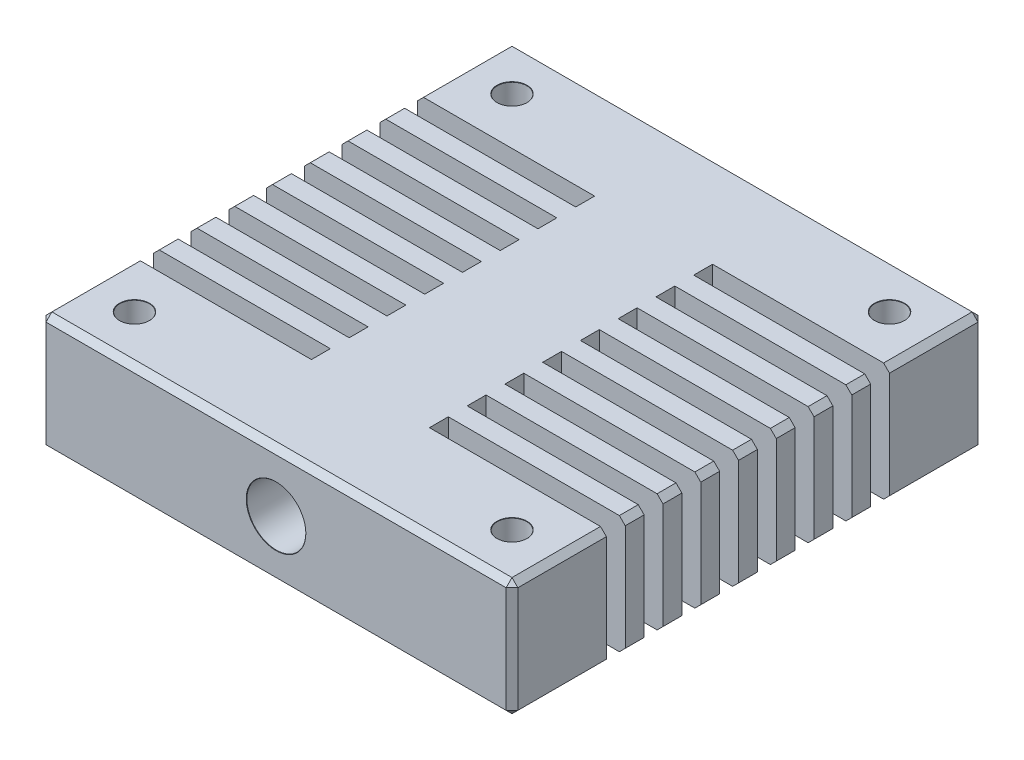
from build123d import *

# Parameters (mm, degrees)
ESQUISSE1_W                                         = 40
ESQUISSE1_H                                         = 40
BOSS_EXTRU_1_DEPTH                                  = 10
DIAM_TRE_DU_PER_AGE_4_0_4_1_D                       = 4
TROU_POUR_TARAUDAGE_POUR_TROU_TARAUD_M6_D           = 5
TROU_POUR_TARAUDAGE_POUR_TROU_TARAUD_M6_DEPTH       = 8
TROU_POUR_TARAUDAGE_POUR_TROU_TARAUD_M6_CSINK_D     = 5.05
TROU_POUR_TARAUDAGE_POUR_TROU_TARAUD_M6_CSINK_ANGLE = 90
TROU_POUR_TARAUDAGE_POUR_TROU_TARAUD_M6_TIP         = 1.502151548
DIAM_TRE_DU_PER_AGE_6_0_6_1_D                       = 6
DIAM_TRE_DU_PER_AGE_6_0_6_1_DEPTH                   = 20
DIAM_TRE_DU_PER_AGE_6_0_6_1_TIP                     = 1.802581857
TROU_POUR_TARAUDAGE_POUR_TROU_TARAUD_2_COUNT        = 2
TROU_POUR_TARAUDAGE_POUR_TROU_TARAUD_2_PITCH        = 32
TROU_POUR_TARAUDAGE_POUR_TROU_TARAUD_3_COUNT        = 2
TROU_POUR_TARAUDAGE_POUR_TROU_TARAUD_3_PITCH        = 45.254833996
TROU_POUR_TARAUDAGE_POUR_TROU_TARAUD_4_COUNT        = 2
TROU_POUR_TARAUDAGE_POUR_TROU_TARAUD_4_PITCH        = 32
TROU_POUR_TARAUDAGE_POUR_TROU_TARAUD_5_D            = 2.5
TROU_POUR_TARAUDAGE_POUR_TROU_TARAUD_5_DEPTH        = 5
TROU_POUR_TARAUDAGE_POUR_TROU_TARAUD_5_CSINK_D      = 2.55
TROU_POUR_TARAUDAGE_POUR_TROU_TARAUD_5_CSINK_ANGLE  = 90
TROU_POUR_TARAUDAGE_POUR_TROU_TARAUD_5_TIP          = 0.751075774
ESQUISSE21_W                                        = 15
ESQUISSE21_H                                        = 1.6
ENL_V_MAT_EXTRU_1_DEPTH                             = 58.445626535
R_P_TITION_LIN_AIRE1_COUNT                          = 8
R_P_TITION_LIN_AIRE1_PITCH                          = 3.2
CHANFREIN1_SIZE                                     = 0.5


with BuildPart() as part:
    # Esquisse1 → Boss.-Extru.1 (new body)
    with BuildSketch(Plane(origin=(0, 0, 0), x_dir=(1, 0, 0), z_dir=(0, 1, 0))):
        with Locations((20, 20)):
            Rectangle(ESQUISSE1_W, ESQUISSE1_H)
    extrude(amount=BOSS_EXTRU_1_DEPTH)

    # Diamètre du perçage Ø4.0 (4)1 (through all)
    with Locations(Plane.XY):
        with Locations((20, 5)):
            Hole(DIAM_TRE_DU_PER_AGE_4_0_4_1_D / 2)

    # Trou pour taraudage pour trou taraudé M61
    with Locations(Plane.XY):
        with Locations((20, 5)):
            CounterSinkHole(TROU_POUR_TARAUDAGE_POUR_TROU_TARAUD_M6_D / 2, TROU_POUR_TARAUDAGE_POUR_TROU_TARAUD_M6_CSINK_D / 2, depth=TROU_POUR_TARAUDAGE_POUR_TROU_TARAUD_M6_DEPTH, counter_sink_angle=TROU_POUR_TARAUDAGE_POUR_TROU_TARAUD_M6_CSINK_ANGLE)
            with Locations((0, 0, -(TROU_POUR_TARAUDAGE_POUR_TROU_TARAUD_M6_DEPTH + TROU_POUR_TARAUDAGE_POUR_TROU_TARAUD_M6_TIP / 2))):  # 118° drill point
                Cone(0, TROU_POUR_TARAUDAGE_POUR_TROU_TARAUD_M6_D / 2, TROU_POUR_TARAUDAGE_POUR_TROU_TARAUD_M6_TIP, mode=Mode.SUBTRACT)

    # Diamètre du perçage Ø6.0 (6)1
    with Locations(Plane(origin=(0, 0, -40), x_dir=(-1, 0, 0), z_dir=(0, 0, -1))):
        with Locations((-20, 5)):
            Hole(DIAM_TRE_DU_PER_AGE_6_0_6_1_D / 2, depth=DIAM_TRE_DU_PER_AGE_6_0_6_1_DEPTH)
            with Locations((0, 0, -(DIAM_TRE_DU_PER_AGE_6_0_6_1_DEPTH + DIAM_TRE_DU_PER_AGE_6_0_6_1_TIP / 2))):  # 118° drill point
                Cone(0, DIAM_TRE_DU_PER_AGE_6_0_6_1_D / 2, DIAM_TRE_DU_PER_AGE_6_0_6_1_TIP, mode=Mode.SUBTRACT)

    # Esquisse17 → Trou pour taraudage pour trou taraud_ M3 (revolve, cut)
    with BuildSketch(Plane(origin=(4, 0, -4), x_dir=(0, 0, -1), z_dir=(1, 0, 0))):
        Polygon((0, 0), (0, 10), (1.275, 10), (1.25, 9.975), (1.25, 0.025), (1.275, 0), align=None)
    trou_pour_taraudage_pour_trou_taraud_m3 = revolve(axis=Axis((4, -6.35, -4), (0, 1, 0)), mode=Mode.SUBTRACT)

    # Trou pour taraudage pour trou taraud 2: Trou pour taraudage pour trou taraud_ M3 ×2
    with Locations(*[(i * TROU_POUR_TARAUDAGE_POUR_TROU_TARAUD_2_PITCH, 0, 0) for i in range(1, TROU_POUR_TARAUDAGE_POUR_TROU_TARAUD_2_COUNT)]):
        add(trou_pour_taraudage_pour_trou_taraud_m3, mode=Mode.SUBTRACT)

    # Trou pour taraudage pour trou taraud 3: Trou pour taraudage pour trou taraud_ M3 ×2
    with Locations(*[Vector(0.7071067811865475, 0, -0.7071067811865476) * (i * TROU_POUR_TARAUDAGE_POUR_TROU_TARAUD_3_PITCH) for i in range(1, TROU_POUR_TARAUDAGE_POUR_TROU_TARAUD_3_COUNT)]):
        add(trou_pour_taraudage_pour_trou_taraud_m3, mode=Mode.SUBTRACT)

    # Trou pour taraudage pour trou taraud 4: Trou pour taraudage pour trou taraud_ M3 ×2
    with Locations(*[(0, 0, -i * TROU_POUR_TARAUDAGE_POUR_TROU_TARAUD_4_PITCH) for i in range(1, TROU_POUR_TARAUDAGE_POUR_TROU_TARAUD_4_COUNT)]):
        add(trou_pour_taraudage_pour_trou_taraud_m3, mode=Mode.SUBTRACT)

    # Trou pour taraudage pour trou taraud 5
    with Locations(Plane(origin=(0, 0, 0), x_dir=(-1, 0, 0), z_dir=(0, -1, 0))):
        with Locations((-20, 36)):
            CounterSinkHole(TROU_POUR_TARAUDAGE_POUR_TROU_TARAUD_5_D / 2, TROU_POUR_TARAUDAGE_POUR_TROU_TARAUD_5_CSINK_D / 2, depth=TROU_POUR_TARAUDAGE_POUR_TROU_TARAUD_5_DEPTH, counter_sink_angle=TROU_POUR_TARAUDAGE_POUR_TROU_TARAUD_5_CSINK_ANGLE)
            with Locations((0, 0, -(TROU_POUR_TARAUDAGE_POUR_TROU_TARAUD_5_DEPTH + TROU_POUR_TARAUDAGE_POUR_TROU_TARAUD_5_TIP / 2))):  # 118° drill point
                Cone(0, TROU_POUR_TARAUDAGE_POUR_TROU_TARAUD_5_D / 2, TROU_POUR_TARAUDAGE_POUR_TROU_TARAUD_5_TIP, mode=Mode.SUBTRACT)

    # Esquisse21 → Enlèv. mat.-Extru.1 (cut, through all)
    with BuildSketch(Plane.XZ):
        with Locations((7.5, -8.8)):
            Rectangle(ESQUISSE21_W, ESQUISSE21_H)
        with Locations((32.5, -8.8)):
            Rectangle(ESQUISSE21_W, ESQUISSE21_H)
    enl_v_mat_extru_1 = extrude(amount=-ENL_V_MAT_EXTRU_1_DEPTH, mode=Mode.SUBTRACT)

    # Répétition linéaire1: Enlèv. mat.-Extru.1 ×8
    with Locations(*[(0, 0, -i * R_P_TITION_LIN_AIRE1_PITCH) for i in range(1, R_P_TITION_LIN_AIRE1_COUNT)]):
        add(enl_v_mat_extru_1, mode=Mode.SUBTRACT)

    # Chanfrein1
    chanfrein1_edges = [part.edges().sort_by_distance(p)[0] for p in [
        (40, 10, -4),
        (0, 0, -10.4),
        (0, 10, -10.4),
        (40, 0, -13.6),
        (40, 10, -13.6),
        (20, 10, -40),
        (0, 0, -13.6),
        (0, 10, -13.6),
        (40, 0, -16.8),
        (40, 10, -16.8),
        (0, 0, -16.8),
        (0, 10, -16.8),
        (40, 0, -20),
        (40, 10, -20),
        (0, 0, -20),
        (0, 10, -20),
        (40, 0, -23.2),
        (40, 10, -23.2),
        (0, 0, -23.2),
        (0, 10, -23.2),
        (40, 0, -26.4),
        (40, 10, -26.4),
        (0, 0, -26.4),
        (0, 10, -26.4),
        (40, 0, -29.6),
        (40, 10, -29.6),
        (0, 0, -29.6),
        (0, 10, -29.6),
        (40, 0, -36),
        (40, 10, -36),
        (0, 10, -36),
        (20, 0, -40),
        (40, 0, -4),
        (20, 0, 0),
        (0, 0, -36),
        (20, 10, 0),
        (0, 0, -4),
        (0, 5, -40),
        (40, 5, -40),
        (0, 10, -4),
        (40, 5, 0),
        (0, 5, 0),
        (40, 0, -10.4),
        (40, 10, -10.4),
    ]]
    chamfer(chanfrein1_edges, length=CHANFREIN1_SIZE)


solid = part.part
